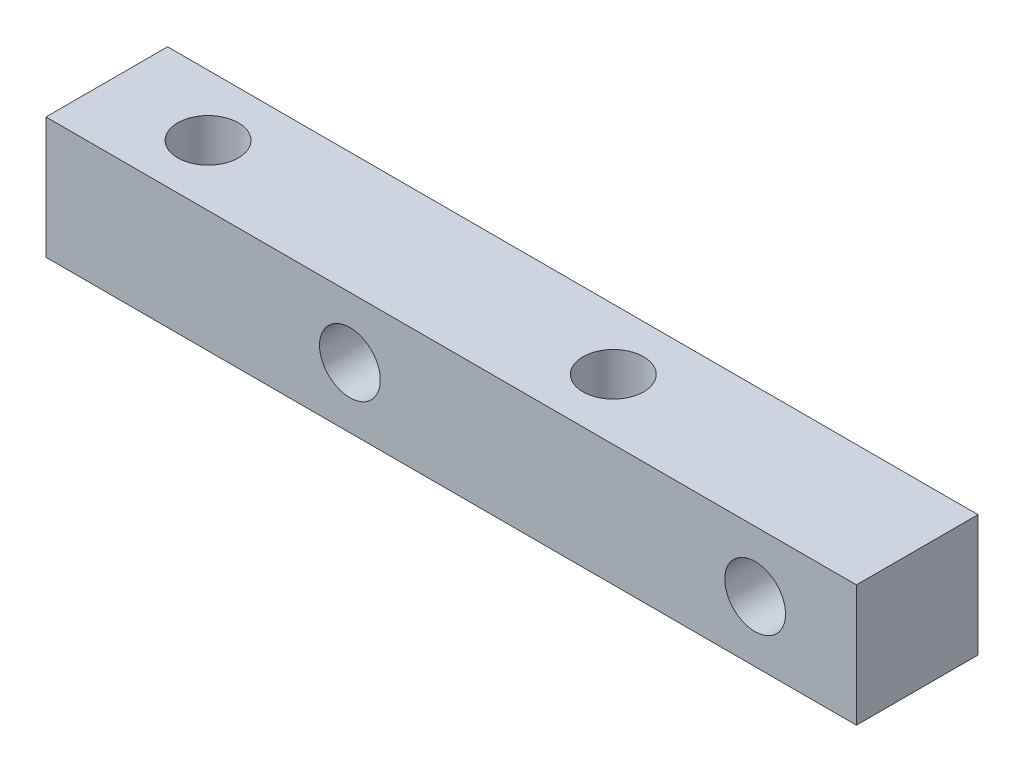
from build123d import *

# Parameters (mm, degrees)
SKETCH_1_W          = 40
SKETCH_1_H          = 6
EXTRUDE_1_DEPTH     = 6
SKETCH_2_R          = 1.5
CUT_EXTRUDE_1_DEPTH = 22.09502311
SKETCH_3_R          = 1.5
CUT_EXTRUDE_2_DEPTH = 22.725560982


with BuildPart() as part:
    # 草图1 → 凸台-拉伸1 (new body)
    with BuildSketch(Plane(origin=(0, 0, 0), x_dir=(1, 0, 0), z_dir=(0, 1, 0))):
        Rectangle(SKETCH_1_W, SKETCH_1_H)
    extrude(amount=EXTRUDE_1_DEPTH)

    # 草图2 → 切除-拉伸1 (cut, through all)
    with BuildSketch(Plane(origin=(0, 6, 0), x_dir=(1, 0, 0), z_dir=(0, 1, 0))):
        with Locations(Location((-15, 0, 0), (0, 0, 270))):
            Circle(SKETCH_2_R)
        with Locations(Location((5, 0, 0), (0, 0, 270))):
            Circle(SKETCH_2_R)
    extrude(amount=-CUT_EXTRUDE_1_DEPTH, mode=Mode.SUBTRACT)

    # 草图3 → 切除-拉伸2 (cut, through all)
    with BuildSketch(Plane(origin=(0, 0, -3), x_dir=(-1, 0, 0), z_dir=(0, 0, -1))):
        with Locations((-15, 3)):
            Circle(SKETCH_3_R)
        with Locations((5, 3)):
            Circle(SKETCH_3_R)
    extrude(amount=-CUT_EXTRUDE_2_DEPTH, mode=Mode.SUBTRACT)


solid = part.part
